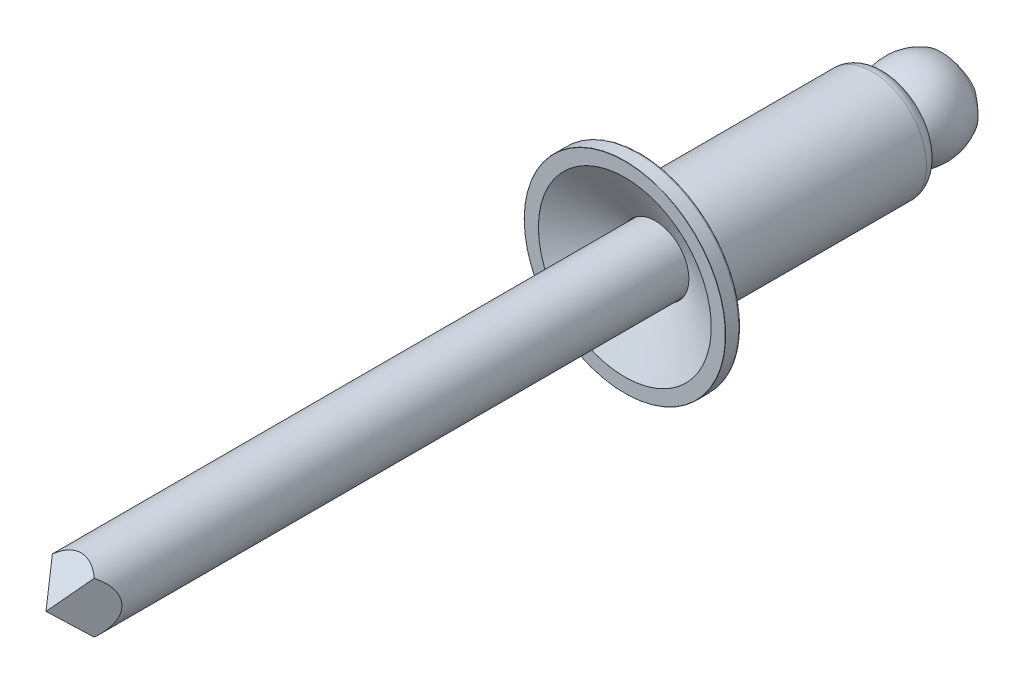
from build123d import *

# Parameters (mm, degrees)
CUT_EXTRUDE1_DEPTH      = 28.912196257
CUT_EXTRUDE1_DEPTH_BACK = 28.912196257
CUT_EXTRUDE2_DEPTH      = 28.912196257
CUT_EXTRUDE2_DEPTH_BACK = 28.912196257
BOSS_EXTRUDE1_DEPTH     = 1.905
CUT_EXTRUDE6_DEPTH      = 28.912196257
CUT_EXTRUDE6_DEPTH_BACK = 28.912196257
FILLET1_R               = 0.09017
FILLET2_R               = 0.009017


with BuildPart() as part:
    # Sketch2 → Revolve1 (revolve)
    with BuildSketch(Plane(origin=(0, 0, 0), x_dir=(0, 0, -1), z_dir=(1, 0, 0)), mode=Mode.PRIVATE) as revolve1_sk:
        with BuildLine():
            Line((-27.2034, 0), (-27.2034, 1.4478))
            Line((-27.2034, 1.4478), (-1.8034, 1.4478))
            Line((-1.8034, 1.4478), (4.52755, 1.4478))
            Line((4.52755, 1.4478), (4.52755, 1.4732))
            Line((4.52755, 1.4732), (-0.464038642, 1.4732))
            Line((-0.464038642, 1.4732), (-1.8034, 3.793041921))
            Line((-1.8034, 3.793041921), (-1.8034, 4.4196))
            Line((-1.8034, 4.4196), (-1.176841921, 4.4196))
            Line((-1.176841921, 4.4196), (0, 2.38125))
            Line((0, 2.38125), (9.0551, 2.38125))
            ThreePointArc((9.0551, 2.38125), (9.512523188, 2.16140105), (9.6266, 1.666875))
            Line((9.6266, 1.666875), (9.407525, 1.4478))
            Line((9.407525, 1.4478), (9.6266, 1.4478))
            ThreePointArc((9.6266, 1.4478), (10.825683647, 1.899538893), (12.076006707, 1.61925))
            Line((12.076006707, 1.61925), (12.076006707, 0))
            Line((12.076006707, 0), (9.6266, 0))
            Line((9.6266, 0), (-27.2034, 0))
        make_face()
    revolve(revolve1_sk.sketch.rotate(Axis((0, 0, 27.2034), (0, 0, -1)), 90), axis=Axis((0, 0, 27.2034), (0, 0, -1)))

    # Sketch3 → Cut-Extrude1 (cut, two sides: drawn at the far end of the back side and taken through both)
    with BuildSketch(Plane(origin=(0, 0, 0), x_dir=(1, 0, 0), z_dir=(0, 1, 0)).offset(-CUT_EXTRUDE1_DEPTH_BACK)):
        Polygon((0, -27.2034), (1.651, -25.051774909), (1.651, -27.7114), (-1.651, -27.7114), (-1.651, -25.051774909), align=None)
    extrude(amount=CUT_EXTRUDE1_DEPTH + CUT_EXTRUDE1_DEPTH_BACK, mode=Mode.SUBTRACT)

    # Sketch5 → Cut-Extrude2 (cut, two sides: drawn at the far end of the back side and taken through both)
    with BuildSketch(Plane(origin=(0, 0, 0), x_dir=(0, 0, -1), z_dir=(1, 0, 0)).offset(-CUT_EXTRUDE2_DEPTH_BACK)):
        Polygon((-27.2034, 0), (-25.316590305, 1.7653), (-27.5209, 1.7653), (-27.5209, -1.7653), (-25.316590305, -1.7653), align=None)
    extrude(amount=CUT_EXTRUDE2_DEPTH + CUT_EXTRUDE2_DEPTH_BACK, mode=Mode.SUBTRACT)

    # Sketch10 → Boss-Extrude1 (add, symmetric)
    with BuildSketch(Plane(origin=(0, 0, 0), x_dir=(0, 0, -1), z_dir=(1, 0, 0))):
        Polygon((12.076006707, 1.61925), (12.4841, 0), (12.076006707, -1.61925), align=None)
    extrude(amount=BOSS_EXTRUDE1_DEPTH, both=True)

    # Sketch12 → Cut-Revolve1 (revolve, cut)
    with BuildSketch(Plane(origin=(0, 0, 0), x_dir=(1, 0, 0), z_dir=(0, 1, 0)), mode=Mode.PRIVATE) as cut_revolve1_sk:
        with BuildLine():
            Line((-0.922633935, 12.4841), (-0.922633935, 15.981066065))
            Line((-0.922633935, 15.981066065), (-4.4196, 15.981066065))
            Line((-4.4196, 15.981066065), (-4.4196, 9.6266))
            Line((-4.4196, 9.6266), (-1.4478, 9.6266))
            ThreePointArc((-1.4478, 9.6266), (-1.899538893, 10.825683647), (-1.61925, 12.076006707))
            ThreePointArc((-1.61925, 12.076006707), (-1.326308952, 12.374564907), (-0.922633935, 12.4841))
        make_face()
    revolve(cut_revolve1_sk.sketch.rotate(Axis((0, 0, 0), (0, 0, -1)), 270), axis=Axis((0, 0, 0), (0, 0, -1)), mode=Mode.SUBTRACT)

    # Sketch13 → Cut-Extrude6 (cut, two sides: drawn at the far end of the back side and taken through both)
    with BuildSketch(Plane(origin=(0, 0, 0), x_dir=(1, 0, 0), z_dir=(0, 1, 0)).offset(-CUT_EXTRUDE6_DEPTH_BACK)):
        Polygon((-0.922633935, 12.4841), (-1.61925, 12.076006707), (-1.61925, 15.981066065), (-0.922633935, 15.981066065), align=None)
        Polygon((1.61925, 12.076006707), (1.61925, 15.981066065), (0.922633935, 15.981066065), (0.922633935, 12.4841), align=None)
    extrude(amount=CUT_EXTRUDE6_DEPTH + CUT_EXTRUDE6_DEPTH_BACK, mode=Mode.SUBTRACT)

    # Fillet1
    fillet1_edges = [part.edges().sort_by_distance(p)[0] for p in [
        (-2.38125, 0, 0),
        (-4.4196, 0, 1.176841921),
    ]]
    fillet(fillet1_edges, radius=FILLET1_R)

    # Fillet2
    fillet2_edges = [part.edges().sort_by_distance(p)[0] for p in [
        (-4.4196, 0, 1.8034),
        (-3.793041921, 0, 1.8034),
    ]]
    fillet(fillet2_edges, radius=FILLET2_R)


solid = part.part
